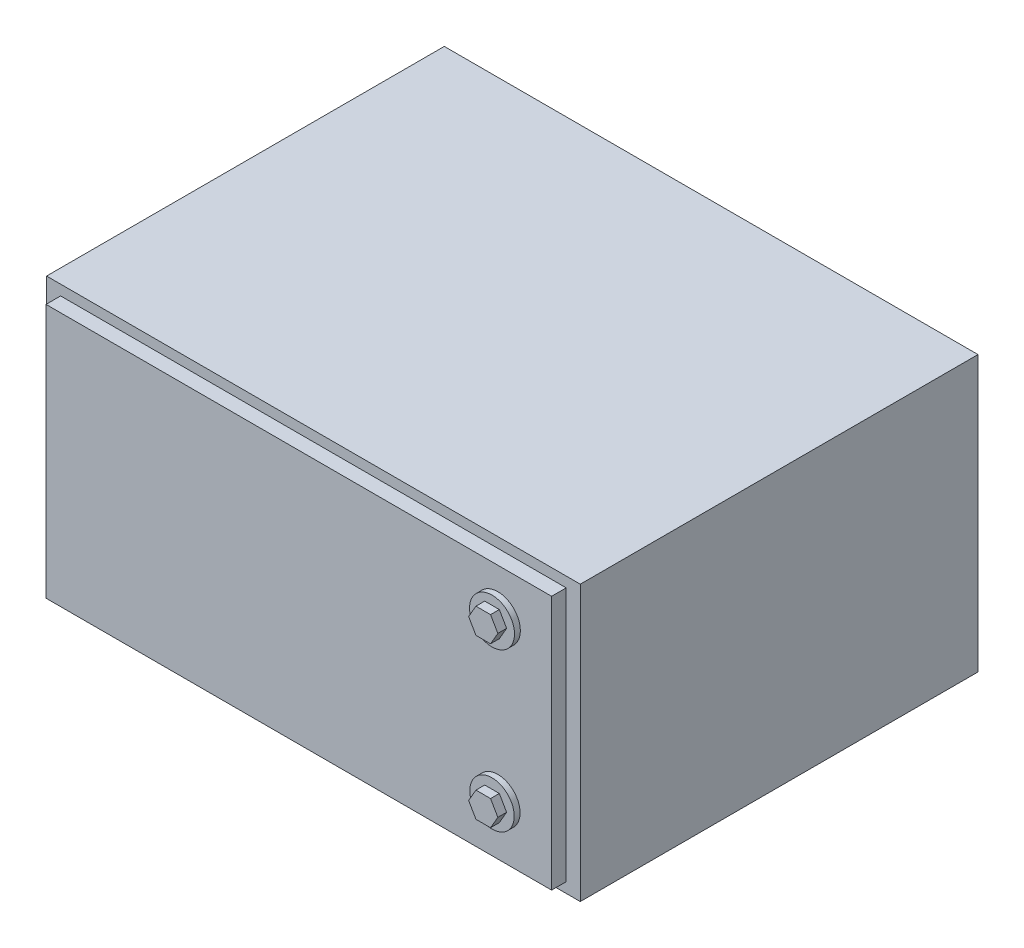
from build123d import *

# Parameters (mm, degrees)
SKETCH2_W           = 365
SKETCH2_H           = 188
BOSS_EXTRUDE1_DEPTH = 272
SKETCH3_W           = 345.774876004
SKETCH3_H           = 174.045166382
BOSS_EXTRUDE2_DEPTH = 10
BOSS_EXTRUDE3_DEPTH = 10
SKETCH5_R           = 15.372297264
SKETCH5_R_2         = 15.186201359
BOSS_EXTRUDE4_DEPTH = 4


with BuildPart() as part:
    # Sketch2 → Boss-Extrude1 (new body)
    with BuildSketch(Plane.XY):
        Rectangle(SKETCH2_W, SKETCH2_H)
    extrude(amount=BOSS_EXTRUDE1_DEPTH)

    # Sketch3 → Boss-Extrude2 (add)
    with BuildSketch(Plane.XY.offset(272)):
        Rectangle(SKETCH3_W, SKETCH3_H)
    extrude(amount=BOSS_EXTRUDE2_DEPTH)

    # Sketch4 → Boss-Extrude3 (add)
    with BuildSketch(Plane.XY.offset(282)):
        Polygon((146.126879862, 56.64254241), (141.134054035, 65.290370416), (131.14840238, 65.290370416), (126.155576553, 56.64254241), (131.14840238, 47.994714404), (141.134054035, 47.994714404), align=None)
        Polygon((146.126879862, -52.289546401), (141.134054035, -43.641718394), (131.14840238, -43.641718394), (126.155576553, -52.289546401), (131.14840238, -60.937374407), (141.134054035, -60.937374407), align=None)
    extrude(amount=BOSS_EXTRUDE3_DEPTH)

    # Sketch5 → Boss-Extrude4 (add)
    with BuildSketch(Plane.XY.offset(282)):
        with Locations((136.141228208, 56.003971115)):
            Circle(SKETCH5_R)
        with Locations((136.141228208, -52.041649492)):
            Circle(SKETCH5_R_2)
    extrude(amount=BOSS_EXTRUDE4_DEPTH)


solid = part.part
